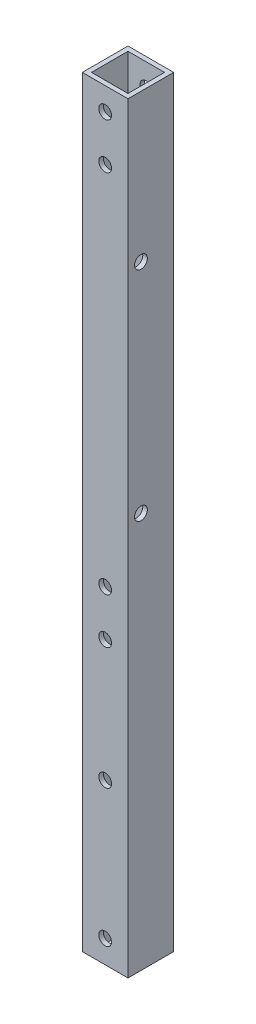
from build123d import *

# Parameters (mm, degrees)
SKETCH_1_W          = 15
SKETCH_1_H          = 15
SKETCH_1_W_2        = 12
SKETCH_1_H_2        = 12
EXTRUDE_1_DEPTH     = 250
SKETCH_2_R          = 2.1
CUT_EXTRUDE_1_DEPTH = 251.561868607
SKETCH_3_R          = 2.1
CUT_EXTRUDE_2_DEPTH = 251.561868607
SKETCH_4_R          = 2.1
CUT_EXTRUDE_3_DEPTH = 251.561868607
SKETCH_5_R          = 2.1
CUT_EXTRUDE_4_DEPTH = 251.561868607


with BuildPart() as part:
    # ｽｹｯﾁ1 → 押し出し-薄板1 (new body)
    with BuildSketch(Plane(origin=(0, 0, 0), x_dir=(1, 0, 0), z_dir=(0, 1, 0))):
        Rectangle(SKETCH_1_W, SKETCH_1_H)
        Rectangle(SKETCH_1_W_2, SKETCH_1_H_2, mode=Mode.SUBTRACT)
    extrude(amount=EXTRUDE_1_DEPTH)

    # ｽｹｯﾁ2 → ｶｯﾄ - 押し出し1 (cut, through all)
    with BuildSketch(Plane.XY.offset(7.5)):
        with Locations((0, 52.5)):
            Circle(SKETCH_2_R)
        with Locations((0, 7.5)):
            Circle(SKETCH_2_R)
    extrude(amount=-CUT_EXTRUDE_1_DEPTH, mode=Mode.SUBTRACT)

    # ｽｹｯﾁ3 → ｶｯﾄ - 押し出し2 (cut, through all)
    with BuildSketch(Plane.XY.offset(7.5)):
        with Locations((0, 107.5)):
            Circle(SKETCH_3_R)
        with Locations((0, 92.5)):
            Circle(SKETCH_3_R)
    extrude(amount=-CUT_EXTRUDE_2_DEPTH, mode=Mode.SUBTRACT)

    # ｽｹｯﾁ4 → ｶｯﾄ - 押し出し3 (cut, through all)
    with BuildSketch(Plane(origin=(7.5, 0, 0), x_dir=(0, 0, -1), z_dir=(1, 0, 0))):
        with Locations((-3.25, 130)):
            Circle(SKETCH_4_R)
        with Locations((-3.25, 201.5)):
            Circle(SKETCH_4_R)
    extrude(amount=-CUT_EXTRUDE_3_DEPTH, mode=Mode.SUBTRACT)

    # ｽｹｯﾁ5 → ｶｯﾄ - 押し出し4 (cut, through all)
    with BuildSketch(Plane.XY.offset(7.5)):
        with Locations((0, 227.5)):
            Circle(SKETCH_5_R)
        with Locations((0, 242.5)):
            Circle(SKETCH_5_R)
    extrude(amount=-CUT_EXTRUDE_4_DEPTH, mode=Mode.SUBTRACT)


solid = part.part
